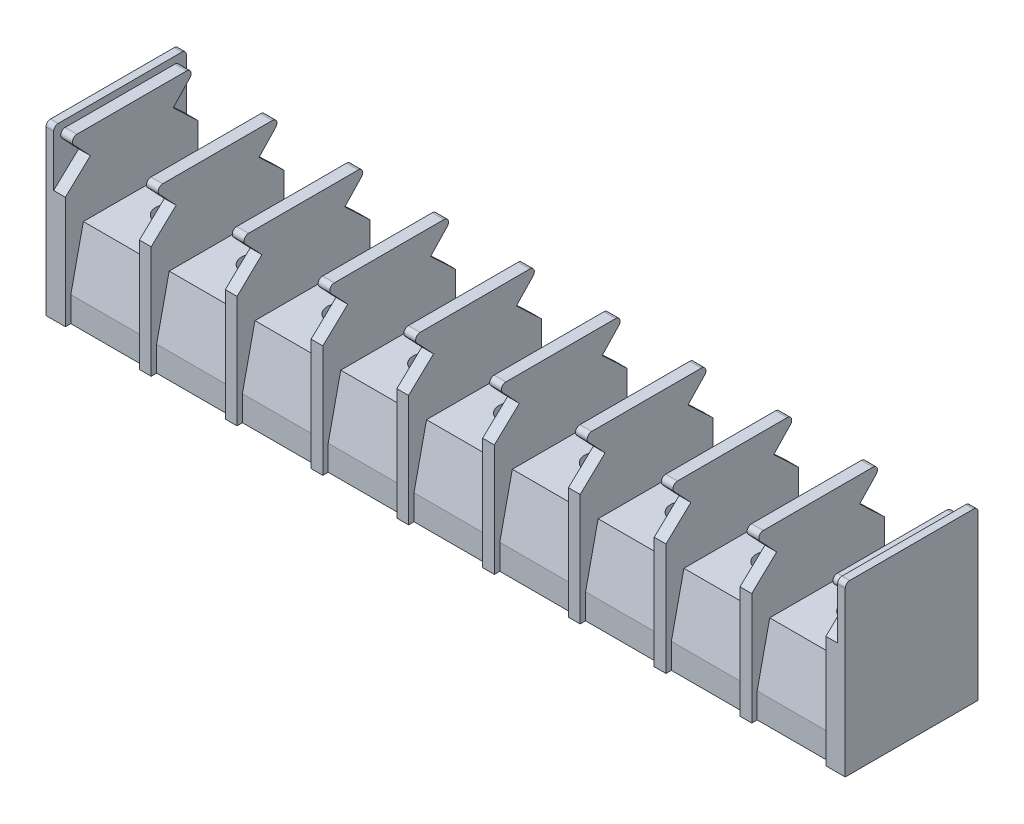
from build123d import *

# Parameters (mm, degrees)
BOSS_EXTRUDE1_DEPTH         = 44.25
BOSS_EXTRUDE2_DEPTH         = 0.85
BOSS_EXTRUDE3_DEPTH         = 1.3
LPATTERN1_COUNT             = 10
LPATTERN1_PITCH             = 9.5
M3_5X0_6_TAPPED_HOLE1_D     = 2.9
M3_5X0_6_TAPPED_HOLE1_DEPTH = 8
M3_5X0_6_TAPPED_HOLE1_TIP   = 0.871247898


with BuildPart() as part:
    # Sketch1 → Boss-Extrude1 (new, symmetric)
    with BuildSketch(Plane(origin=(0, 0, 0), x_dir=(0, 0, -1), z_dir=(1, 0, 0))):
        Polygon((6.75, 0), (6.75, 2.79), (5.365, 9.1), (-5.365, 9.1), (-6.75, 2.79), (-6.75, 0), align=None)
    extrude(amount=BOSS_EXTRUDE1_DEPTH, both=True)

    # Sketch3 → Boss-Extrude2 (add)
    with BuildSketch(Plane(origin=(44.25, 0, 0), x_dir=(0, 0, -1), z_dir=(1, 0, 0))):
        with BuildLine():
            Line((-6.75, 0), (-7.35, 0))
            Line((-7.35, 0), (-7.35, 18.1))
            ThreePointArc((-7.35, 18.1), (-7.203553391, 18.453553391), (-6.85, 18.6))
            Line((-6.85, 18.6), (6.85, 18.6))
            ThreePointArc((6.85, 18.6), (7.203553391, 18.453553391), (7.35, 18.1))
            Line((7.35, 18.1), (7.35, 0))
            Line((7.35, 0), (6.75, 0))
            Line((6.75, 0), (6.75, 2.79))
            Line((6.75, 2.79), (5.365, 9.1))
            Line((5.365, 9.1), (-5.365, 9.1))
            Line((-5.365, 9.1), (-6.75, 2.79))
            Line((-6.75, 2.79), (-6.75, 0))
        make_face()
    boss_extrude2 = extrude(amount=-BOSS_EXTRUDE2_DEPTH)

    # Mirror1: Boss-Extrude2 across plane
    add(boss_extrude2.mirror(Plane(origin=(0, 0, 0), x_dir=(0, 0, 1), z_dir=(1, 0, 0))))

    # Sketch4 → Boss-Extrude3 (add)
    with BuildSketch(Plane.ZY.offset(-43.4)):
        with BuildLine():
            Line((7.35, 0), (7.35, 12.42))
            Line((7.35, 12.42), (4.588898397, 15.03))
            Line((4.588898397, 15.03), (6.438355915, 16.98652878))
            ThreePointArc((6.438355915, 16.98652878), (6.534203446, 17.527818591), (6.075, 17.83))
            Line((6.075, 17.83), (-6.075, 17.83))
            ThreePointArc((-6.075, 17.83), (-6.534203446, 17.527818591), (-6.438355915, 16.98652878))
            Line((-6.438355915, 16.98652878), (-4.588898397, 15.03))
            Line((-4.588898397, 15.03), (-7.35, 12.42))
            Line((-7.35, 12.42), (-7.35, 0))
            Line((-7.35, 0), (-6.75, 0))
            Line((-6.75, 0), (-6.75, 2.79))
            Line((-6.75, 2.79), (-5.365, 9.1))
            Line((-5.365, 9.1), (5.365, 9.1))
            Line((5.365, 9.1), (6.75, 2.79))
            Line((6.75, 2.79), (6.75, 0))
            Line((6.75, 0), (7.35, 0))
        make_face()
    boss_extrude3 = extrude(amount=BOSS_EXTRUDE3_DEPTH)

    # LPattern1: Boss-Extrude3 ×10
    with Locations(*[(-i * LPATTERN1_PITCH, 0, 0) for i in range(1, LPATTERN1_COUNT)]):
        add(boss_extrude3)

    # M3.5x0.6 Tapped Hole1
    with Locations(Plane(origin=(0, 9.1, 0), x_dir=(1, 0, 0), z_dir=(0, 1, 0))):
        with Locations((-38, 0), (-28.5, 0), (-19, 0), (-9.5, 0), (0, 0), (9.5, 0), (19, 0), (28.5, 0), (38, 0)):
            Hole(M3_5X0_6_TAPPED_HOLE1_D / 2, depth=M3_5X0_6_TAPPED_HOLE1_DEPTH)
            with Locations((0, 0, -(M3_5X0_6_TAPPED_HOLE1_DEPTH + M3_5X0_6_TAPPED_HOLE1_TIP / 2))):  # 118° drill point
                Cone(0, M3_5X0_6_TAPPED_HOLE1_D / 2, M3_5X0_6_TAPPED_HOLE1_TIP, mode=Mode.SUBTRACT)


solid = part.part
